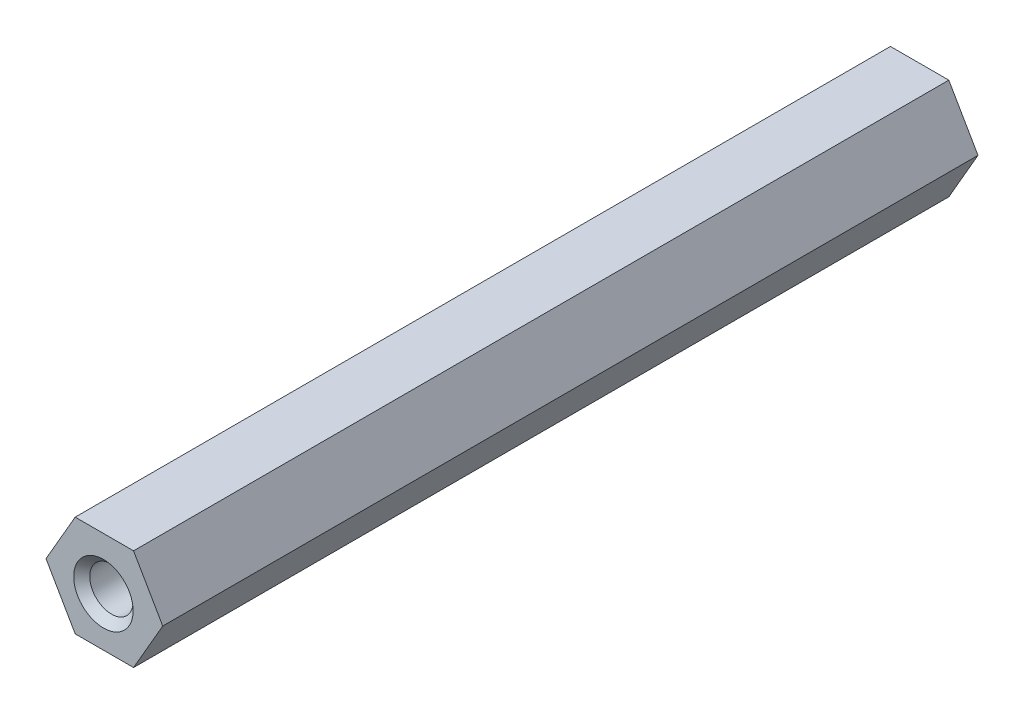
from build123d import *

# Parameters (mm, degrees)
BOSS_EXTRUDE1_DEPTH   = 25.4
F_6_32_TAPPED_HOLE8_D = 2.7051
CHAMFER1_SIZE         = 0.5
CHAMFER2_SIZE         = 0.5


with BuildPart() as part:
    # Sketch1 → Boss-Extrude1 (new, symmetric)
    with BuildSketch(Plane.XY):
        Polygon((3.637306696, 0), (1.818653348, 3.15), (-1.818653348, 3.15), (-3.637306696, 0), (-1.818653348, -3.15), (1.818653348, -3.15), align=None)
    extrude(amount=BOSS_EXTRUDE1_DEPTH, both=True)

    # #6-32 Tapped Hole8 (through all)
    with Locations(Plane(origin=(-0.058753338, -0.101763766, 25.4), x_dir=(1, 0, 0), z_dir=(0, 0, 1))):
        with Locations((0, 0)):
            Hole(F_6_32_TAPPED_HOLE8_D / 2)

    # Chamfer1
    chamfer1_edges = [part.edges().sort_by_distance(p)[0] for p in [
        (1.293796662, -0.101763766, 25.4),
    ]]
    chamfer(chamfer1_edges, length=CHAMFER1_SIZE)

    # Chamfer2
    chamfer2_edges = [part.edges().sort_by_distance(p)[0] for p in [
        (1.293796662, -0.101763766, -25.4),
    ]]
    chamfer(chamfer2_edges, length=CHAMFER2_SIZE)


solid = part.part
